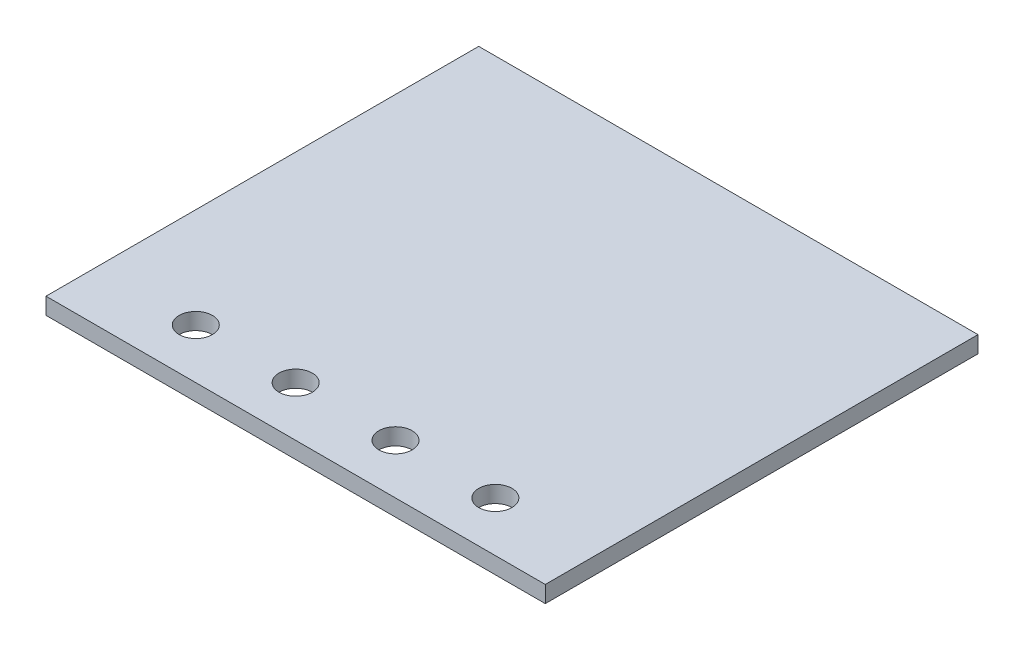
from build123d import *

# Parameters (mm, degrees)
SKETCH1_W           = 300
SKETCH1_H           = 260
BOSS_EXTRUDE1_DEPTH = 10
SKETCH2_R           = 10
CUT_EXTRUDE1_DEPTH  = 199.746069144
LPATTERN1_COUNT     = 4
LPATTERN1_PITCH     = 60


with BuildPart() as part:
    # Sketch1 → Boss-Extrude1 (new body)
    with BuildSketch(Plane(origin=(0, 0, 0), x_dir=(1, 0, 0), z_dir=(0, 1, 0))):
        Rectangle(SKETCH1_W, SKETCH1_H)
    extrude(amount=BOSS_EXTRUDE1_DEPTH)

    # Sketch2 → Cut-Extrude1 (cut, through all)
    with BuildSketch(Plane(origin=(0, 10, 0), x_dir=(1, 0, 0), z_dir=(0, 1, 0))):
        with Locations(Location((-90, -100, 0), (0, 0, 270))):
            Circle(SKETCH2_R)
    cut_extrude1 = extrude(amount=-CUT_EXTRUDE1_DEPTH, mode=Mode.SUBTRACT)

    # LPattern1: Cut-Extrude1 ×4
    with Locations(*[(i * LPATTERN1_PITCH, 0, 0) for i in range(1, LPATTERN1_COUNT)]):
        add(cut_extrude1, mode=Mode.SUBTRACT)


solid = part.part
